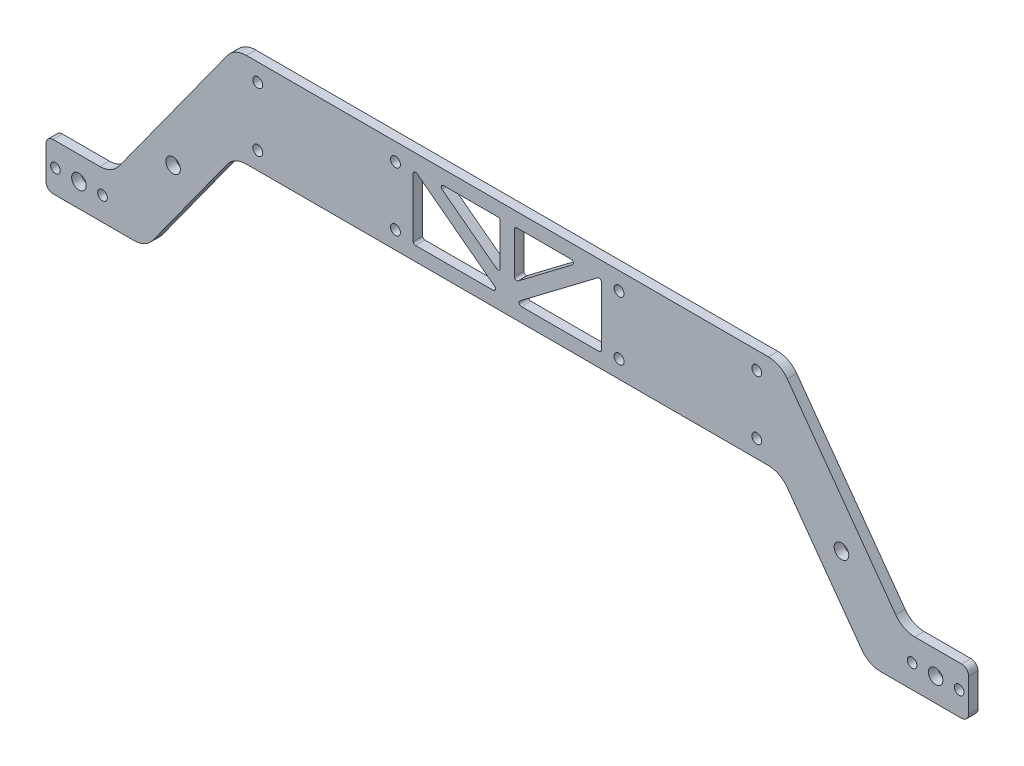
from build123d import *

# Parameters (mm, degrees)
SKETCH_1_W          = 232
SKETCH_1_H          = 40
SKETCH_1_R          = 2.1
EXTRUDE_1_DEPTH     = 4
SKETCH_2_R          = 3.1
EXTRUDE_2_DEPTH     = 4
SKETCH_4_R          = 2.1
CUT_EXTRUDE_2_DEPTH = 10
FILLET_1_R          = 3
FILLET_2_R          = 10
SKETCH_6_R          = 2.05
SKETCH_6_R_2        = 3.1
CUT_EXTRUDE_4_DEPTH = 209.844439715
CUT_EXTRUDE_5_DEPTH = 10
FILLET_3_R          = 1


with BuildPart() as part:
    # 草图1 → 凸台-拉伸1 (new body)
    with BuildSketch(Plane.XY):
        Rectangle(SKETCH_1_W, SKETCH_1_H)
        with Locations((-47.5, 12.5)):
            Circle(SKETCH_1_R, mode=Mode.SUBTRACT)
        with Locations((47.5, 12.5)):
            Circle(SKETCH_1_R, mode=Mode.SUBTRACT)
        with Locations((-47.5, -12.5)):
            Circle(SKETCH_1_R, mode=Mode.SUBTRACT)
        with Locations((47.5, -12.5)):
            Circle(SKETCH_1_R, mode=Mode.SUBTRACT)
    extrude(amount=EXTRUDE_1_DEPTH)

    # 草图2 → 凸台-拉伸2 (add)
    # profile 1 of 2: a face of its own
    with BuildSketch(Plane.XY.offset(4)):
        Polygon((-116, 20), (-168, -52), (-196, -52), (-196, -72), (-153.555555556, -72), (-116, -20), align=None)
        with Locations((-142, -36)):
            Circle(SKETCH_2_R, mode=Mode.SUBTRACT)
    # profile 2 of 2: a face of its own
    with BuildSketch(Plane.XY.offset(4)):
        Polygon((116, 20), (168, -52), (196, -52), (196, -72), (153.555555556, -72), (116, -20), align=None)
        with Locations(Location((142, -36, 0), (0, 0, 180))):
            Circle(SKETCH_2_R, mode=Mode.SUBTRACT)
    extrude(amount=-EXTRUDE_2_DEPTH)

    # 草图4 → 切除-拉伸2 (cut)
    with BuildSketch(Plane.XY.offset(4)):
        with Locations((-106, 12.5)):
            Circle(SKETCH_4_R)
        with Locations((-106, -12.5)):
            Circle(SKETCH_4_R)
        with Locations((106, 12.5)):
            Circle(SKETCH_4_R)
        with Locations((106, -12.5)):
            Circle(SKETCH_4_R)
    extrude(amount=-CUT_EXTRUDE_2_DEPTH, mode=Mode.SUBTRACT)

    # 圆角1
    fillet_1_edges = [part.edges().sort_by_distance(p)[0] for p in [
        (-196, -72, 2),
        (-196, -52, 2),
        (196, -52, 2),
        (196, -72, 2),
    ]]
    fillet(fillet_1_edges, radius=FILLET_1_R)

    # 圆角2
    fillet_2_edges = [part.edges().sort_by_distance(p)[0] for p in [
        (-153.555555556, -72, 2),
        (-168, -52, 2),
        (168, -52, 2),
        (153.555555556, -72, 2),
        (116, -20, 2),
        (-116, -20, 2),
        (-116, 20, 2),
        (116, 20, 2),
    ]]
    fillet(fillet_2_edges, radius=FILLET_2_R)

    # 草图6 → 切除-拉伸4 (cut, through all)
    with BuildSketch(Plane.XY.offset(4)):
        with Locations((-192, -62)):
            Circle(SKETCH_6_R)
        with Locations((-172, -62)):
            Circle(SKETCH_6_R)
        with Locations(Location((172, -62, 0), (0, 0, 180))):
            Circle(SKETCH_6_R)
        with Locations(Location((192, -62, 0), (0, 0, 180))):
            Circle(SKETCH_6_R)
        with Locations((-182, -62)):
            Circle(SKETCH_6_R_2)
        with Locations((182, -62)):
            Circle(SKETCH_6_R_2)
    extrude(amount=-CUT_EXTRUDE_4_DEPTH, mode=Mode.SUBTRACT)

    # 草图5 → 切除-拉伸5 (cut)
    with BuildSketch(Plane.XY.offset(4)):
        Polygon((-40, 14), (-40, -14), (-3, -14), align=None)
        Polygon((-30.057050493, 14), (-3, -6.475605779), (-3, 14), align=None)
        Polygon((40, -14), (3, -14), (40, 14), align=None)
        Polygon((3, -6.475605779), (3, 14), (30.057050493, 14), align=None)
    extrude(amount=-CUT_EXTRUDE_5_DEPTH, mode=Mode.SUBTRACT)

    # 圆角3
    fillet_3_edges = [part.edges().sort_by_distance(p)[0] for p in [
        (-3, 14, 2),
        (-3, -6.475605779, 2),
        (-30.057050493, 14, 2),
        (3, 14, 2),
        (30.057050493, 14, 2),
        (3, -6.475605779, 2),
        (3, -14, 2),
        (40, 14, 2),
        (40, -14, 2),
        (-3, -14, 2),
        (-40, -14, 2),
        (-40, 14, 2),
    ]]
    fillet(fillet_3_edges, radius=FILLET_3_R)


solid = part.part
